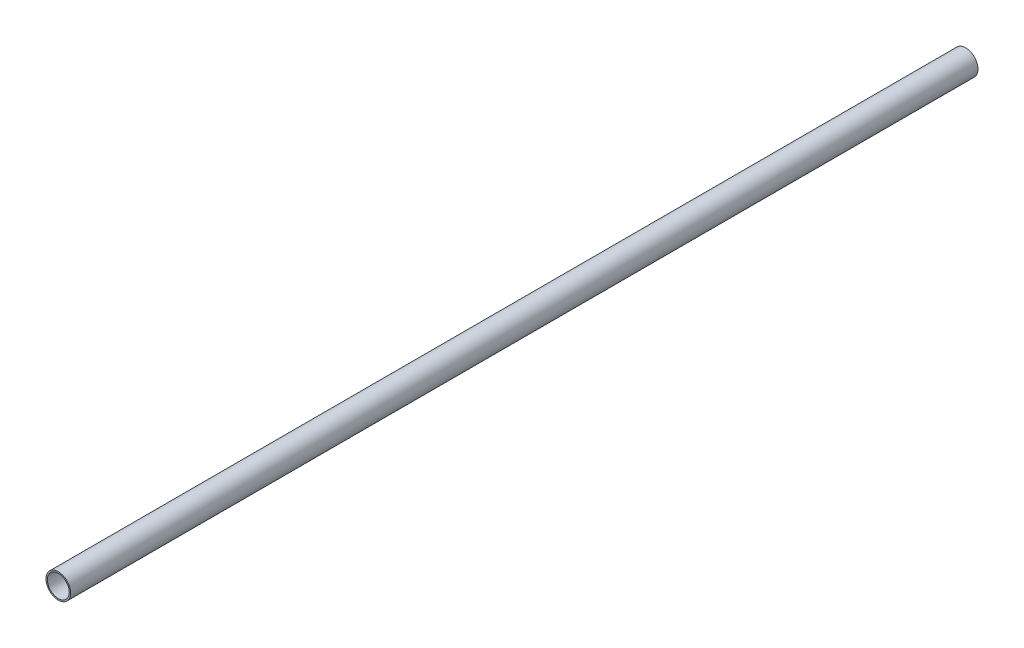
from build123d import *

# Parameters (mm, degrees)
SKETCH1_R           = 7.9375
SKETCH1_R_2         = 7.0485
BOSS_EXTRUDE1_DEPTH = 292.1


with BuildPart() as part:
    # Sketch1 → Boss-Extrude1 (new, symmetric)
    with BuildSketch(Plane.XY):
        Circle(SKETCH1_R)
        Circle(SKETCH1_R_2, mode=Mode.SUBTRACT)
    extrude(amount=BOSS_EXTRUDE1_DEPTH, both=True)


solid = part.part
